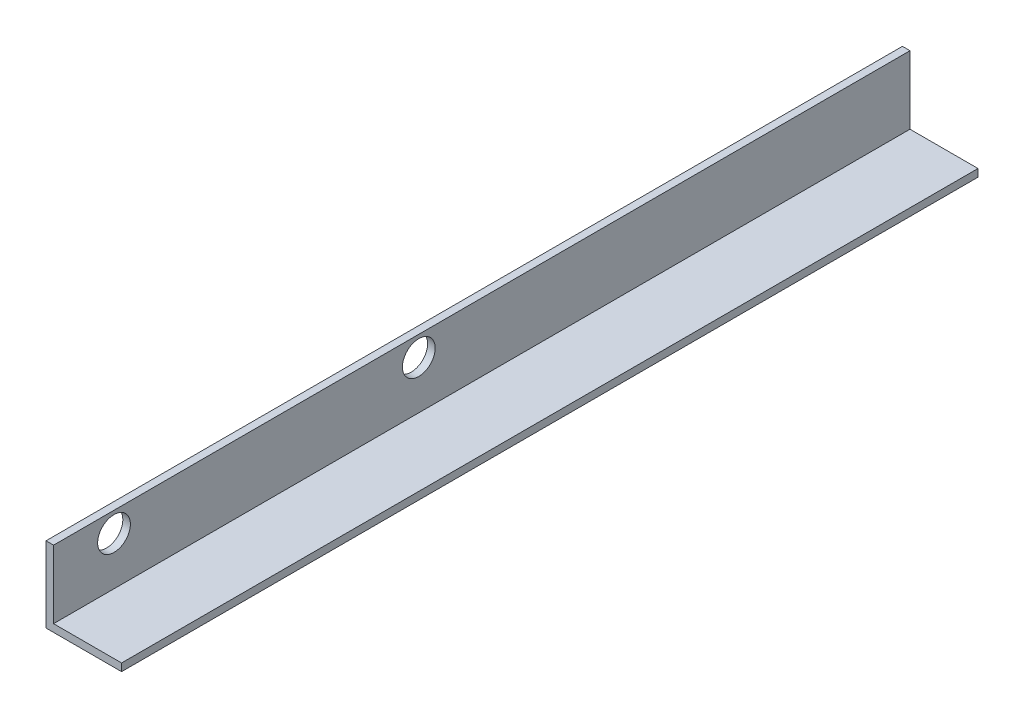
from build123d import *

# Parameters (mm, degrees)
ESTRUSIONE_ESTRUSIONE1_DEPTH = 340
SCHIZZO2_R                   = 6.5
TAGLIO_ESTRUSIONE1_DEPTH     = 343.387207705


with BuildPart() as part:
    # Schizzo1 → Estrusione-Estrusione1 (new body)
    with BuildSketch(Plane.XY):
        Polygon((0, 30), (0, 0), (30, 0), (30, 3), (3, 3), (3, 30), align=None)
    extrude(amount=ESTRUSIONE_ESTRUSIONE1_DEPTH)

    # Schizzo2 → Taglio-Estrusione1 (cut, through all)
    with BuildSketch(Plane(origin=(3, 0, 0), x_dir=(0, 0, -1), z_dir=(1, 0, 0))):
        with Locations((-195, 22)):
            Circle(SCHIZZO2_R)
        with Locations((-316, 22)):
            Circle(SCHIZZO2_R)
    extrude(amount=-TAGLIO_ESTRUSIONE1_DEPTH, mode=Mode.SUBTRACT)


solid = part.part
